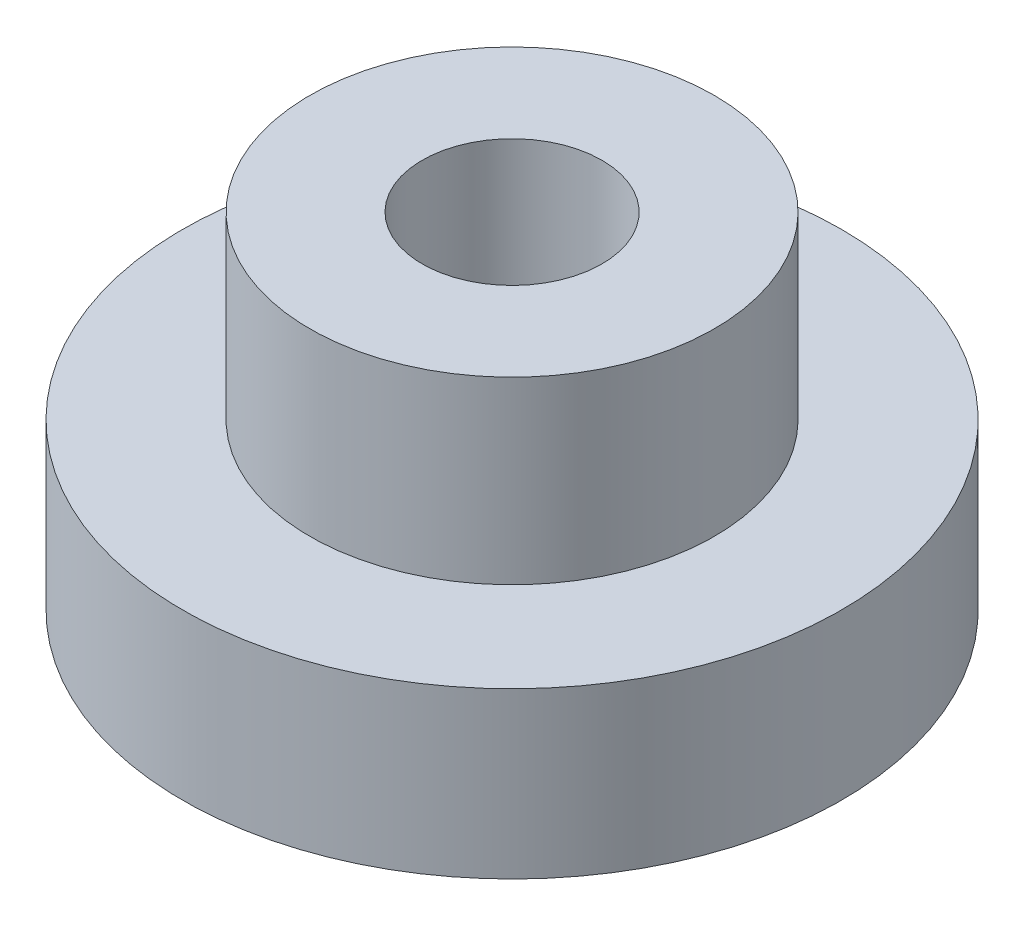
from build123d import *


with BuildPart() as part:
    # Эскиз1 → Повернуть1 (revolve)
    with BuildSketch(Plane.XY, mode=Mode.PRIVATE) as revolve_1_sk:
        Polygon((6, 23), (6, 0), (22, 0), (22, 11), (13.5, 11), (13.5, 23), align=None)
    revolve(revolve_1_sk.sketch.rotate(Axis((0, 0, 0), (0, 1, 0)), 90), axis=Axis((0, 0, 0), (0, 1, 0)))


solid = part.part
